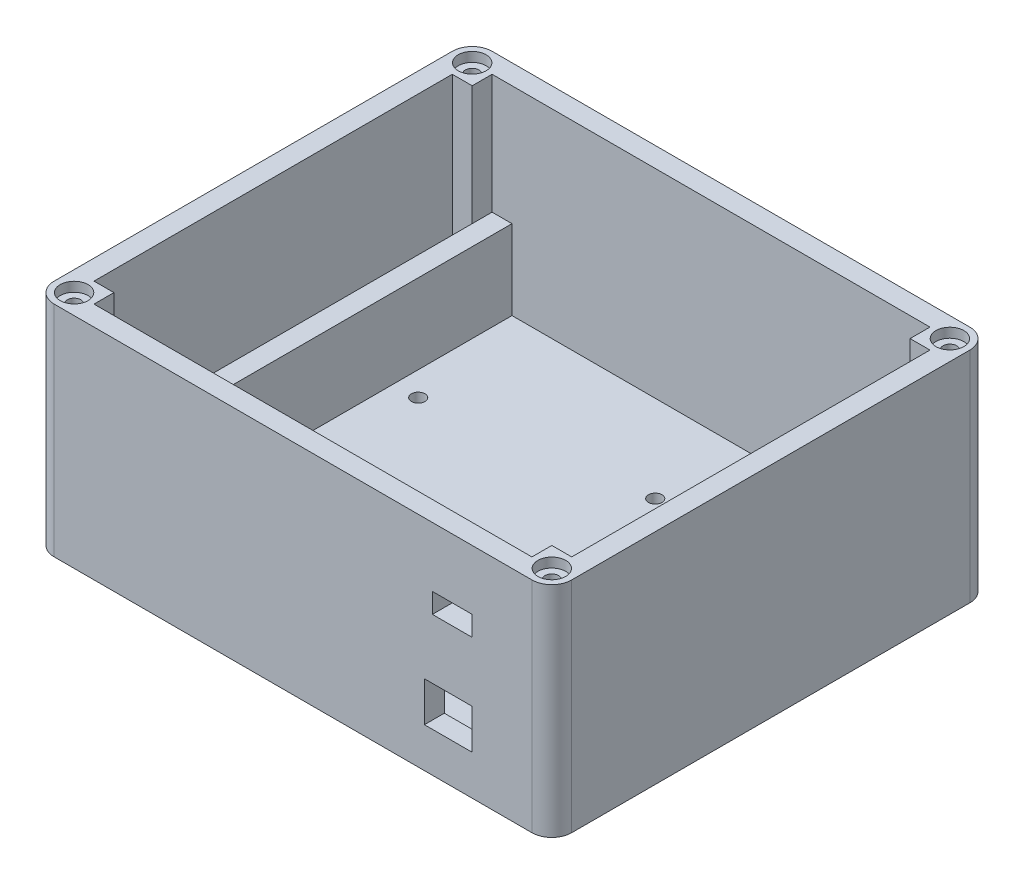
from build123d import *

# Parameters (mm, degrees)
SKETCH1_W                                        = 130
SKETCH1_H                                        = 110
BOSS_EXTRUDE1_DEPTH                              = 5
SKETCH2_W                                        = 130
SKETCH2_H                                        = 110
BOSS_EXTRUDE2_DEPTH                              = 50
CBORE_FOR_M3_PAN_HEAD_MACHINE_SCREW1_D           = 3.4
CBORE_FOR_M3_PAN_HEAD_MACHINE_SCREW1_DEPTH       = 7
CBORE_FOR_M3_PAN_HEAD_MACHINE_SCREW1_CBORE_D     = 7
CBORE_FOR_M3_PAN_HEAD_MACHINE_SCREW1_CBORE_DEPTH = 2.4
CBORE_FOR_M3_PAN_HEAD_MACHINE_SCREW1_TIP         = 1.021463052
CBORE_FOR_M3_PAN_HEAD_MACHINE_SCREW2_D           = 3.4
CBORE_FOR_M3_PAN_HEAD_MACHINE_SCREW2_DEPTH       = 7
CBORE_FOR_M3_PAN_HEAD_MACHINE_SCREW2_CBORE_D     = 7
CBORE_FOR_M3_PAN_HEAD_MACHINE_SCREW2_CBORE_DEPTH = 2.4
CBORE_FOR_M3_PAN_HEAD_MACHINE_SCREW2_TIP         = 1.021463052
BOSS_EXTRUDE3_REACH                              = 177.926
SKETCH8_W                                        = 5
SKETCH8_H                                        = 20
SKETCH9_W                                        = 5
SKETCH9_H                                        = 20
BOSS_EXTRUDE4_DEPTH                              = 100
CUT_EXTRUDE2_REACH                               = 180.955
SKETCH10_W                                       = 12
SKETCH10_H                                       = 10
CUT_EXTRUDE3_REACH                               = 180.955
SKETCH11_W                                       = 10
SKETCH11_H                                       = 5
FILLET6_R                                        = 5


with BuildPart() as part:
    # Sketch1 → Boss-Extrude1 (new body)
    with BuildSketch(Plane(origin=(0, 0, 0), x_dir=(1, 0, 0), z_dir=(0, 1, 0))):
        with Locations((65, -55)):
            Rectangle(SKETCH1_W, SKETCH1_H)
    extrude(amount=BOSS_EXTRUDE1_DEPTH)

    # Sketch2 → Boss-Extrude2 (add)
    with BuildSketch(Plane(origin=(0, 5, 0), x_dir=(1, 0, 0), z_dir=(0, 1, 0))):
        with Locations((65, -55)):
            Rectangle(SKETCH2_W, SKETCH2_H)
        Polygon((10, -105), (120, -105), (120, -100), (125, -100), (125, -10), (120, -10), (120, -5), (10, -5), (10, -10), (5, -10), (5, -100), (10, -100), align=None, mode=Mode.SUBTRACT)
    extrude(amount=BOSS_EXTRUDE2_DEPTH)

    # CBORE for M3 Pan Head Machine Screw1
    with Locations(Plane(origin=(0, 55, 0), x_dir=(1, 0, 0), z_dir=(0, 1, 0))):
        with Locations((5, -5), (125, -105), (5, -105), (125, -5)):
            CounterBoreHole(CBORE_FOR_M3_PAN_HEAD_MACHINE_SCREW1_D / 2, CBORE_FOR_M3_PAN_HEAD_MACHINE_SCREW1_CBORE_D / 2, CBORE_FOR_M3_PAN_HEAD_MACHINE_SCREW1_CBORE_DEPTH, depth=CBORE_FOR_M3_PAN_HEAD_MACHINE_SCREW1_DEPTH)
            with Locations((0, 0, -(CBORE_FOR_M3_PAN_HEAD_MACHINE_SCREW1_DEPTH + CBORE_FOR_M3_PAN_HEAD_MACHINE_SCREW1_TIP / 2))):  # 118° drill point
                Cone(0, CBORE_FOR_M3_PAN_HEAD_MACHINE_SCREW1_D / 2, CBORE_FOR_M3_PAN_HEAD_MACHINE_SCREW1_TIP, mode=Mode.SUBTRACT)

    # CBORE for M3 Pan Head Machine Screw2
    with Locations(Plane(origin=(0, 0, 0), x_dir=(-1, 0, 0), z_dir=(0, -1, 0))):
        with Locations((-74.07, -75.08), (-72.8, -26.82), (-22.538761246, -62.532927336), (-21.069252595, -34.631598616)):
            CounterBoreHole(CBORE_FOR_M3_PAN_HEAD_MACHINE_SCREW2_D / 2, CBORE_FOR_M3_PAN_HEAD_MACHINE_SCREW2_CBORE_D / 2, CBORE_FOR_M3_PAN_HEAD_MACHINE_SCREW2_CBORE_DEPTH, depth=CBORE_FOR_M3_PAN_HEAD_MACHINE_SCREW2_DEPTH)
            with Locations((0, 0, -(CBORE_FOR_M3_PAN_HEAD_MACHINE_SCREW2_DEPTH + CBORE_FOR_M3_PAN_HEAD_MACHINE_SCREW2_TIP / 2))):  # 118° drill point
                Cone(0, CBORE_FOR_M3_PAN_HEAD_MACHINE_SCREW2_D / 2, CBORE_FOR_M3_PAN_HEAD_MACHINE_SCREW2_TIP, mode=Mode.SUBTRACT)

    # Boss-Extrude3: up to this face of the body (flat: up to its plane)
    boss_extrude3_end = Plane(part.part.faces().sort_by_distance((65, 30, 105))[0])
    # Sketch8 → Boss-Extrude3 (add, up to the picked face)
    with BuildSketch(Plane.XY.offset(5), mode=Mode.PRIVATE) as boss_extrude3_sk1:
        with Locations((117.5, 15)):
            Rectangle(SKETCH8_W, SKETCH8_H)
    boss_extrude3_tool1 = split(extrude(boss_extrude3_sk1.sketch, amount=BOSS_EXTRUDE3_REACH, mode=Mode.PRIVATE), bisect_by=boss_extrude3_end, keep=Keep.BOTH, mode=Mode.PRIVATE)
    add(boss_extrude3_tool1.solids().sort_by(Axis((117.5, 15, 5), (0, 0, 1)))[0])

    # Sketch9 → Boss-Extrude4 (add)
    with BuildSketch(Plane.XY.offset(5)):
        with Locations((12.5, 15)):
            Rectangle(SKETCH9_W, SKETCH9_H)
    extrude(amount=BOSS_EXTRUDE4_DEPTH)

    # Sketch10 → Cut-Extrude2 (cut, up to next)
    with BuildSketch(Plane.XY.offset(110), mode=Mode.PRIVATE) as cut_extrude2_sk1:
        with Locations((104, 15)):
            Rectangle(SKETCH10_W, SKETCH10_H)
    cut_extrude2_tool1 = extrude(cut_extrude2_sk1.sketch, amount=-CUT_EXTRUDE2_REACH, mode=Mode.PRIVATE) & part.part
    add(cut_extrude2_tool1.solids().sort_by_distance((104, 15, 110))[0], mode=Mode.SUBTRACT)

    # Sketch11 → Cut-Extrude3 (cut, up to next)
    with BuildSketch(Plane.XY.offset(110), mode=Mode.PRIVATE) as cut_extrude3_sk1:
        with Locations((105, 37.5)):
            Rectangle(SKETCH11_W, SKETCH11_H)
    cut_extrude3_tool1 = extrude(cut_extrude3_sk1.sketch, amount=-CUT_EXTRUDE3_REACH, mode=Mode.PRIVATE) & part.part
    add(cut_extrude3_tool1.solids().sort_by_distance((105, 37.5, 110))[0], mode=Mode.SUBTRACT)

    # Fillet6
    fillet6_edges = [part.edges().sort_by_distance(p)[0] for p in [
        (0, 27.5, 0),
        (130, 27.5, 0),
        (130, 27.5, 110),
        (0, 27.5, 110),
    ]]
    fillet(fillet6_edges, radius=FILLET6_R)


solid = part.part
